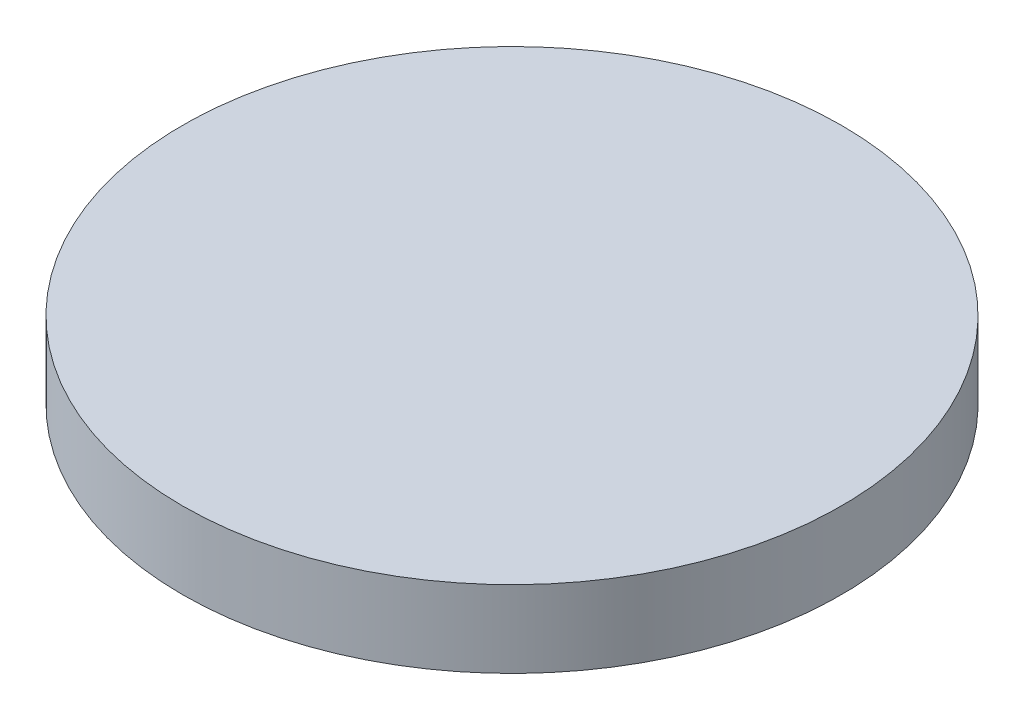
from build123d import *

# Parameters (mm, degrees)
SKDISCOVINILO_R   = 60
DISCOVINILO_DEPTH = 14


with BuildPart() as part:
    # SkDiscoVinilo → DiscoVinilo (new body)
    with BuildSketch(Plane(origin=(0, 18, 0), x_dir=(1, 0, 0), z_dir=(0, 1, 0))):
        with Locations(Location((0, 0, 0), (0, 0, 90))):
            Circle(SKDISCOVINILO_R)
    extrude(amount=DISCOVINILO_DEPTH)


solid = part.part
